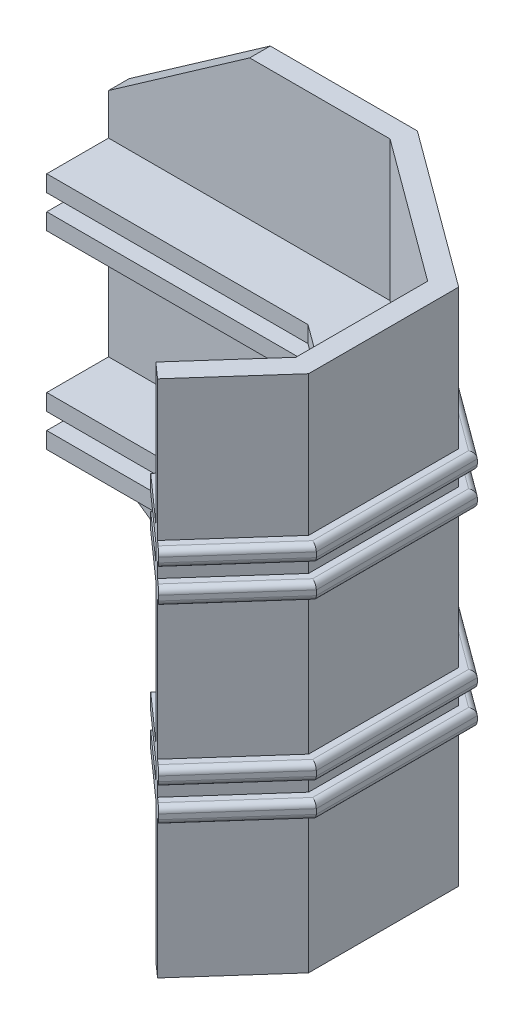
from build123d import *

# Parameters (mm, degrees)
EXTRUDE_1_DEPTH        = 31.5
EXTRUDE_1_DEPTH_BACK   = 31.5
CHAMFER_1_SIZE         = 12
CHAMFER_1_SIZE2        = 17.137776081
EXTRUDE_1_2_DEPTH      = 2
EXTRUDE_2_DEPTH        = 2
FILLET_1_R             = 0.7
FILLET_1_OF_MIRROR_1_R = 0.7


with BuildPart() as part:
    # 草图1 → Extrude 1 (new, two sides: drawn at the far end of the back side and taken through both)
    with BuildSketch(Plane(origin=(0, 0, 0), x_dir=(1, 0, 0), z_dir=(0, 1, 0)).offset(-EXTRUDE_1_DEPTH_BACK)):
        Polygon((0, -8), (0, 8), (-17.240931671, 20.67715564), (-51.420742101, 20.67715564), (-51.420742101, 23.17715564), (-16.420742101, 23.17715564), (2.5, 9.264845271), (2.5, -8.950498306), (-6.131476703, -18.660909597), (-8, -17), align=None)
    extrude(amount=EXTRUDE_1_DEPTH + EXTRUDE_1_DEPTH_BACK)

    # 倒角1
    chamfer_1_edges = [part.edges().sort_by_distance(p)[0] for p in [
        (-51.420742101, -31.5, -21.92715564),
        (-51.420742101, 31.5, -21.92715564),
    ]]
    chamfer_1_side = [part.faces().sort_by_distance(p)[0] for p in [
        (-51.420742101, 0, -21.92715564),
    ]]
    chamfer(chamfer_1_edges, length=CHAMFER_1_SIZE, length2=CHAMFER_1_SIZE2, reference=chamfer_1_side[0])

    # 草图4 → Extrude 1 2 (add)
    with BuildSketch(Plane(origin=(0, 10.5, 0), x_dir=(1, 0, 0), z_dir=(0, 1, 0))):
        Polygon((-6.131476703, -18.660909597), (2.5, -8.950498306), (2.5, 9.264845271), (-16.420742101, 23.17715564), (-34.282966021, 23.17715564), (-51.420742101, 23.17715564), (-51.420742101, 13.17715564), (-34.282966021, 13.17715564), (-19.701500378, 13.17715564), (-7.5, 4.205464186), (-7.5, -5.148505082), (-13.60556989, -12.017271209), align=None)
        Polygon((-5.010362725, -19.657455355), (4, -9.520797289), (4, 10.023752434), (-15.92862836, 24.67715564), (-34.282966021, 24.67715564), (-51.420742101, 24.67715564), (-51.420742101, 14.67715564), (-34.282966021, 14.67715564), (-19.209386637, 14.67715564), (-6, 4.964371348), (-6, -5.718804066), (-12.484455912, -13.013816967), align=None)
    extrude_1_2 = extrude(amount=-EXTRUDE_1_2_DEPTH)

    # 草图5 → 拉伸-薄壁2 (add)
    with BuildSketch(Plane(origin=(0, 14.5, 0), x_dir=(1, 0, 0), z_dir=(0, 1, 0))):
        Polygon((-6.131476703, -18.660909597), (2.5, -8.950498306), (2.5, 9.264845271), (-16.420742101, 23.17715564), (-34.282966021, 23.17715564), (-51.420742101, 23.17715564), (-51.420742101, 13.17715564), (-34.282966021, 13.17715564), (-19.701500378, 13.17715564), (-7.5, 4.205464186), (-7.5, -5.148505082), (-13.60556989, -12.017271209), align=None)
        Polygon((-5.010362725, -19.657455355), (4, -9.520797289), (4, 10.023752434), (-15.92862836, 24.67715564), (-34.282966021, 24.67715564), (-51.420742101, 24.67715564), (-51.420742101, 14.67715564), (-34.282966021, 14.67715564), (-19.209386637, 14.67715564), (-6, 4.964371348), (-6, -5.718804066), (-12.484455912, -13.013816967), align=None)
    extrude_2 = extrude(amount=-EXTRUDE_2_DEPTH)

    # 圆角1
    fillet_1_edges = [part.edges().sort_by_distance(p)[0] for p in [
        (-0.505181363, 8.5, 14.589126322),
        (4, 8.5, -0.251477572),
        (-5.96431418, 8.5, -17.350454037),
        (-33.674685231, 8.5, -24.67715564),
        (-0.505181363, 10.5, 14.589126322),
        (4, 10.5, -0.251477572),
        (-5.96431418, 10.5, -17.350454037),
        (-33.674685231, 10.5, -24.67715564),
        (-33.674685231, 12.5, -24.67715564),
        (-5.96431418, 12.5, -17.350454037),
        (4, 12.5, -0.251477572),
        (-0.505181363, 12.5, 14.589126322),
        (-0.505181363, 14.5, 14.589126322),
        (4, 14.5, -0.251477572),
        (-5.96431418, 14.5, -17.350454037),
        (-33.674685231, 14.5, -24.67715564),
    ]]
    fillet(fillet_1_edges, radius=FILLET_1_R)

    # 镜向1: Extrude 1 2, 拉伸-薄壁2 across plane
    add(extrude_1_2.mirror(Plane.ZX))
    add(extrude_2.mirror(Plane.ZX))

    # 圆角1 of 镜向1
    fillet_1_of_mirror_1_edges = [part.edges().sort_by_distance(p)[0] for p in [
        (-0.505181363, -8.5, 14.589126322),
        (4, -8.5, -0.251477572),
        (-5.96431418, -8.5, -17.350454037),
        (-33.674685231, -8.5, -24.67715564),
        (-0.505181363, -10.5, 14.589126322),
        (4, -10.5, -0.251477572),
        (-5.96431418, -10.5, -17.350454037),
        (-33.674685231, -10.5, -24.67715564),
        (-33.674685231, -12.5, -24.67715564),
        (-5.96431418, -12.5, -17.350454037),
        (4, -12.5, -0.251477572),
        (-0.505181363, -12.5, 14.589126322),
        (-0.505181363, -14.5, 14.589126322),
        (4, -14.5, -0.251477572),
        (-5.96431418, -14.5, -17.350454037),
        (-33.674685231, -14.5, -24.67715564),
    ]]
    fillet(fillet_1_of_mirror_1_edges, radius=FILLET_1_OF_MIRROR_1_R)


solid = part.part
